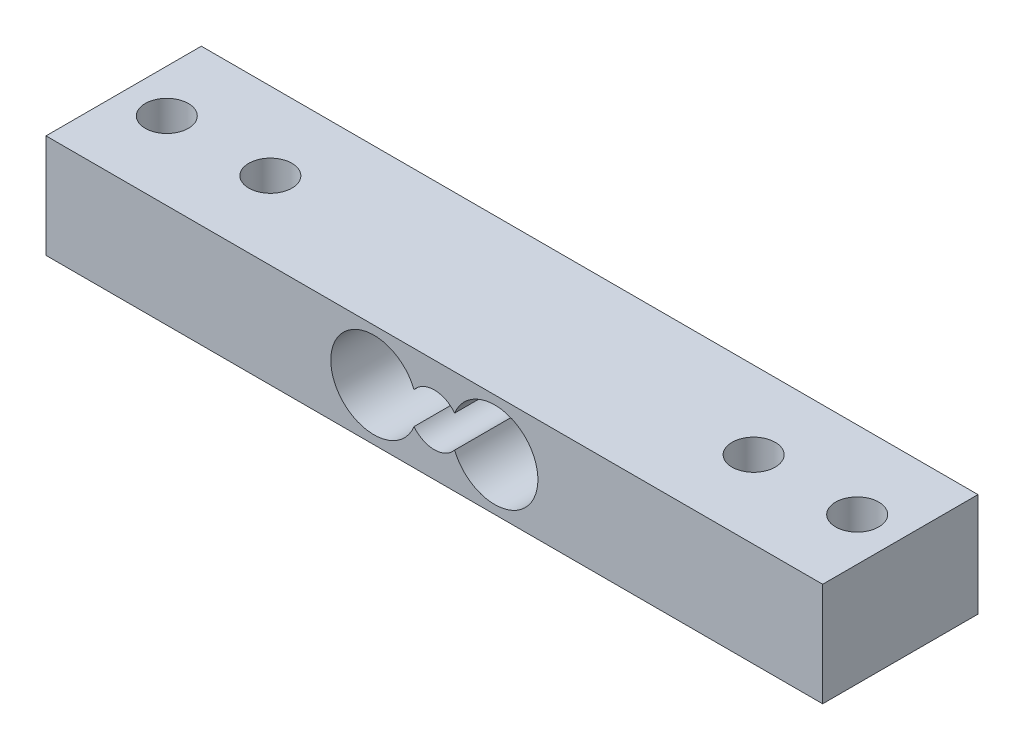
from build123d import *

# Parameters (mm, degrees)
SKETCH_1_W          = 45
SKETCH_1_H          = 9
EXTRUDE_1_DEPTH     = 6
HOLE_WIZARD_M3_1_D  = 2.5
CUT_EXTRUDE_1_DEPTH = 47.281745862


with BuildPart() as part:
    # 草图1 → 凸台-拉伸1 (new body)
    with BuildSketch(Plane(origin=(0, 0, 0), x_dir=(1, 0, 0), z_dir=(0, 1, 0))):
        with Locations((22.5, 4.5)):
            Rectangle(SKETCH_1_W, SKETCH_1_H)
    extrude(amount=EXTRUDE_1_DEPTH)

    # M3 螺纹孔1 (through all)
    with Locations(Plane(origin=(0, 6, 0), x_dir=(1, 0, 0), z_dir=(0, 1, 0))):
        with Locations((2.5, 4.5), (8.5, 4.5), (36.5, 4.5), (42.5, 4.5)):
            Hole(HOLE_WIZARD_M3_1_D / 2)

    # 草图4 → 切除-拉伸1 (cut, through all)
    with BuildSketch(Plane.XY):
        with BuildLine():
            ThreePointArc((21.321428571, 2.072115639), (22.5, 1.5), (23.678571429, 2.072115639))
            ThreePointArc((23.678571429, 2.072115639), (28.5, 3), (23.678571429, 3.927884361))
            ThreePointArc((23.678571429, 3.927884361), (22.5, 4.5), (21.321428571, 3.927884361))
            ThreePointArc((21.321428571, 3.927884361), (16.5, 3), (21.321428571, 2.072115639))
        make_face()
    extrude(amount=-CUT_EXTRUDE_1_DEPTH, mode=Mode.SUBTRACT)


solid = part.part
